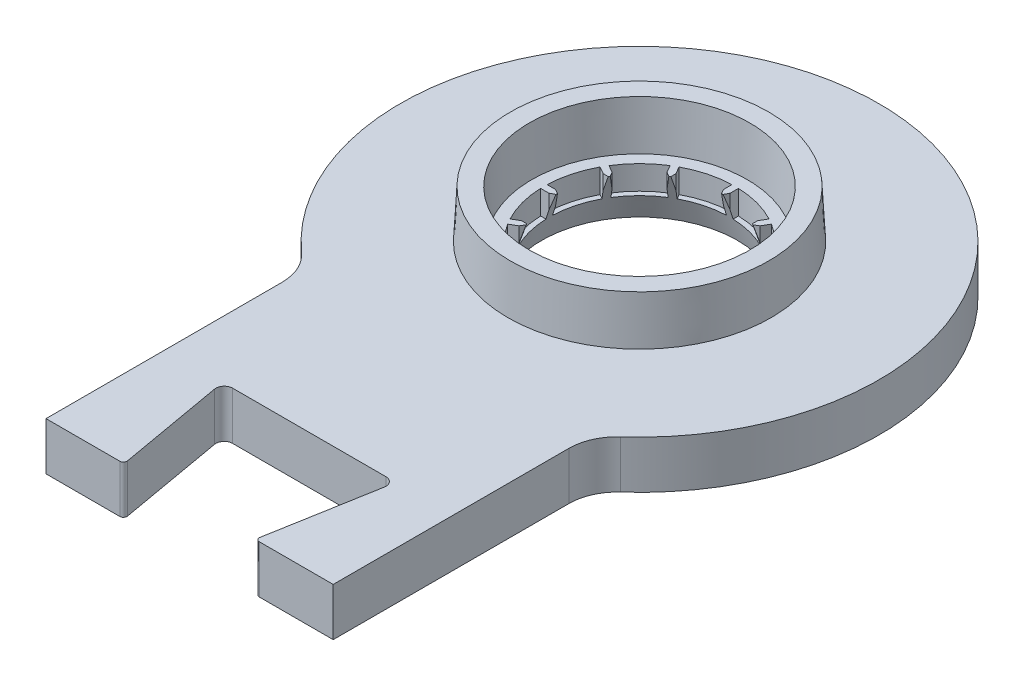
from build123d import *

# Parameters (mm, degrees)
SKETCH1_R           = 3.75
BOSS_EXTRUDE1_DEPTH = 2
SKETCH2_R           = 10
SKETCH2_R_2         = 3.8
BOSS_EXTRUDE2_DEPTH = 2
SKETCH4_W           = 12
SKETCH4_H           = 0.2
CUT_EXTRUDE1_DEPTH  = 4
FILLET3_R           = 0.35
FILLET4_R           = 0.15
FILLET6_R           = 2
SKETCH10_R          = 4
CUT_EXTRUDE4_DEPTH  = 1
BOSS_EXTRUDE6_DEPTH = 2
CIRPATTERN1_COUNT   = 12
SKETCH11_R          = 5.5
SKETCH11_R_2        = 4.5
BOSS_EXTRUDE7_DEPTH = 2
BOSS_EXTRUDE7_DRAFT = 3


with BuildPart() as part:
    # Sketch1 → Boss-Extrude1 (new body)
    with BuildSketch(Plane(origin=(0, 0, 0), x_dir=(1, 0, 0), z_dir=(0, 1, 0))):
        Polygon((-6, 6), (-6, -13.291502622), (-6, -19), (-2.70227506, -19), (-3.619175359, -13.8), (0, -13.8), (3.619175359, -13.8), (2.70227506, -19), (6, -19), (6, -13.291502622), (6, 6), align=None)
        with Locations(Location((0, 0, 0), (0, 0, 270))):
            Circle(SKETCH1_R, mode=Mode.SUBTRACT)
    extrude(amount=BOSS_EXTRUDE1_DEPTH)

    # Sketch2 → Boss-Extrude2 (add)
    with BuildSketch(Plane(origin=(0, 0, 0), x_dir=(1, 0, 0), z_dir=(0, 1, 0))):
        Circle(SKETCH2_R)
        Circle(SKETCH2_R_2, mode=Mode.SUBTRACT)
    extrude(amount=BOSS_EXTRUDE2_DEPTH)

    # Sketch4 → Cut-Extrude1 (cut)
    with BuildSketch(Plane(origin=(0, 2, 0), x_dir=(1, 0, 0), z_dir=(0, 1, 0))):
        with Locations((0, -18.9)):
            Rectangle(SKETCH4_W, SKETCH4_H)
    extrude(amount=-CUT_EXTRUDE1_DEPTH, mode=Mode.SUBTRACT)

    # Fillet3
    fillet3_edges = [part.edges().sort_by_distance(p)[0] for p in [
        (3.619175359, 1, 13.8),
        (-3.619175359, 1, 13.8),
    ]]
    fillet(fillet3_edges, radius=FILLET3_R)

    # Fillet4
    fillet4_edges = [part.edges().sort_by_distance(p)[0] for p in [
        (2.737540456, 1, 18.8),
        (-2.737540456, 1, 18.8),
    ]]
    fillet(fillet4_edges, radius=FILLET4_R)

    # Fillet6
    fillet6_edges = [part.edges().sort_by_distance(p)[0] for p in [
        (6, 1, 8),
        (-6, 1, 8),
    ]]
    fillet(fillet6_edges, radius=FILLET6_R)

    # Sketch10 → Cut-Extrude4 (cut)
    with BuildSketch(Plane(origin=(0, 2, 0), x_dir=(1, 0, 0), z_dir=(0, 1, 0))):
        with Locations(Location((0, 0, 0), (0, 0, 270))):
            Circle(SKETCH10_R)
    extrude(amount=-CUT_EXTRUDE4_DEPTH, mode=Mode.SUBTRACT)

    # Sketch8 → Boss-Extrude6 (add)
    with BuildSketch(Plane(origin=(0, 2, 0), x_dir=(1, 0, 0), z_dir=(0, 1, 0))):
        Polygon((-0.136342372, 3.65), (0, 3.4), (0.136342372, 3.65), (0.136342372, 4.15), (-0.136342372, 4.15), align=None)
    boss_extrude6 = extrude(amount=-BOSS_EXTRUDE6_DEPTH)

    # CirPattern1: Boss-Extrude6 ×12 about axis
    cirpattern1_axis = Axis((0, 0, 0), (0, 1, 0))
    for i in range(1, CIRPATTERN1_COUNT):
        add(boss_extrude6.rotate(cirpattern1_axis, i * 360 / CIRPATTERN1_COUNT))

    # Sketch9 → Cut-Revolve2 (revolve, cut)
    with BuildSketch(Plane(origin=(0, 0, 0), x_dir=(0, 0, -1), z_dir=(1, 0, 0)), mode=Mode.PRIVATE) as cut_revolve2_sk:
        Polygon((3.4, 2.184766015), (4.2, -0.335462065), (0, -0.335462065), (0, 2.184766015), align=None)
    revolve(cut_revolve2_sk.sketch.rotate(Axis((0, 0, 0), (0, 1, 0)), 0.528559578), axis=Axis((0, 0, 0), (0, 1, 0)), mode=Mode.SUBTRACT)


with BuildPart() as boss_extrude7_tool:
    # Sketch11 → Boss-Extrude7 (with draft: the straight prism first)
    with BuildSketch(Plane(origin=(0, 2, 0), x_dir=(1, 0, 0), z_dir=(0, 1, 0))):
        Circle(SKETCH11_R)
        Circle(SKETCH11_R_2, mode=Mode.SUBTRACT)
    extrude(amount=BOSS_EXTRUDE7_DEPTH)
    # Boss-Extrude7: the draft: its side faces are tilted about the plane it starts from
    boss_extrude7_sides = [boss_extrude7_tool.faces().sort_by_distance(p)[0] for p in [
        (-5.5, 3, 0),
        (-4.5, 3, 0),
    ]]
    draft(boss_extrude7_sides, Plane(origin=(0, 2, 0), x_dir=(1, 0, 0), z_dir=(0, 1, 0)), BOSS_EXTRUDE7_DRAFT)


with BuildPart() as part_1:
    add(part.part)

    # Boss-Extrude7: add boss_extrude7_tool
    add(boss_extrude7_tool.part)


solid = part_1.part
